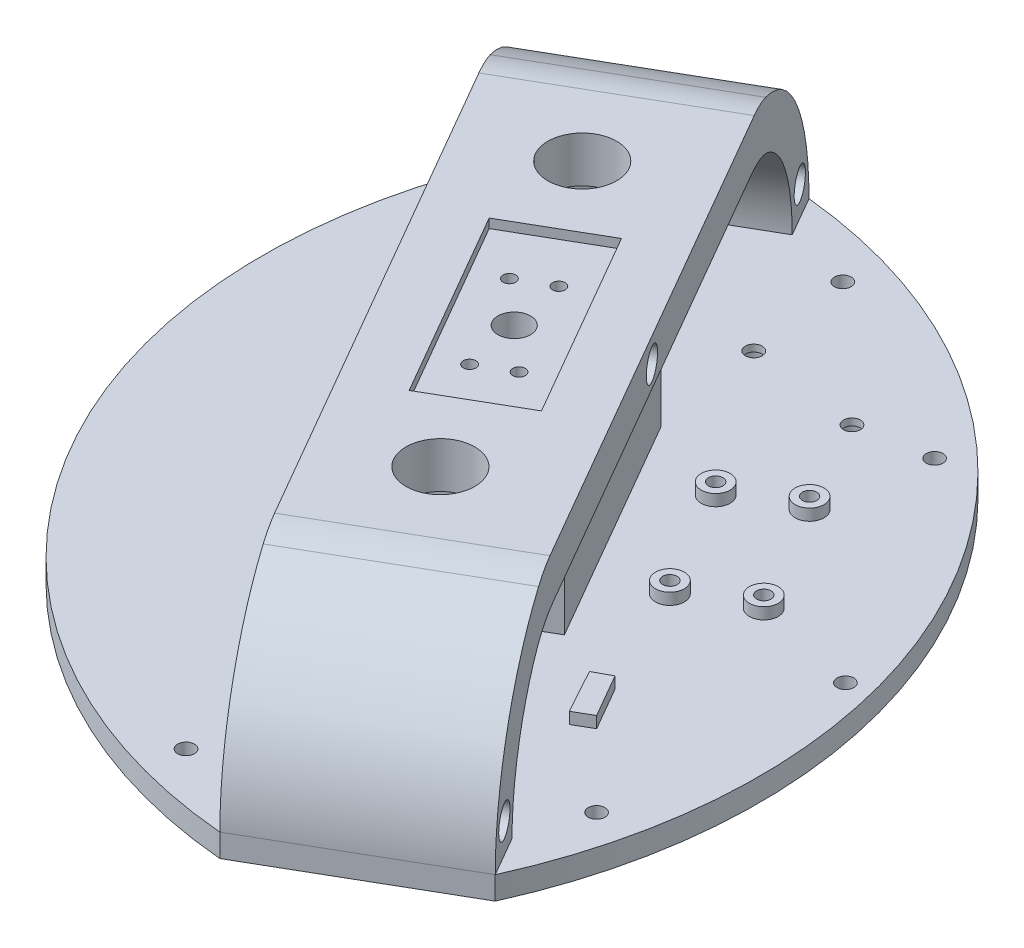
from build123d import *

# Parameters (mm, degrees)
BOSS_EXTRUDE1_DEPTH      = 8.255
SKETCH2_R                = 4.52165068
CUT_EXTRUDE1_DEPTH       = 24.892
BOSS_EXTRUDE2_DEPTH      = 2.54
BOSS_EXTRUDE2_DEPTH_BACK = 19.05
BOSS_EXTRUDE3_DEPTH      = 55.87439679
SKETCH8_W                = 306.493093546
SKETCH8_H                = 19.05
BOSS_EXTRUDE4_DEPTH      = 55.87439679
SKETCH9_R                = 88.9
BOSS_EXTRUDE5_DEPTH      = 19.05
SKETCH10_W               = 191.766813877
SKETCH10_H               = 13.52799874
BOSS_EXTRUDE6_DEPTH      = 55.87439679
SKETCH12_R               = 1.75
CUT_EXTRUDE3_DEPTH       = 25.146
SKETCH14_R               = 9.525
CUT_EXTRUDE4_DEPTH       = 30.48
CUT_EXTRUDE5_DEPTH       = 55.118
SKETCH16_R               = 79.375
CUT_EXTRUDE6_DEPTH       = 16.129
CUT_EXTRUDE7_DEPTH       = 8.89
CUT_EXTRUDE8_DEPTH       = 2.54
SKETCH19_W               = 282.174011185
SKETCH19_H               = 80.01
CUT_EXTRUDE9_DEPTH       = 75.946
BOSS_EXTRUDE7_DEPTH      = 6.35
BOSS_EXTRUDE8_DEPTH      = 48.26
SKETCH22_W               = 20.018863695
SKETCH22_H               = 30.79393733
CUT_EXTRUDE10_DEPTH      = 96.52
BOSS_EXTRUDE9_DEPTH      = 55.87439679
FILLET1_R                = 25.4
SKETCH24_W               = 0.282619494
SKETCH24_H               = 12.7
BOSS_EXTRUDE10_DEPTH     = 55.87439679
FILLET2_R                = 25.4
SKETCH25_R               = 2.3368
CUT_EXTRUDE11_DEPTH      = 21.336
SKETCH27_R               = 4.627670089
BOSS_EXTRUDE11_DEPTH     = 6.35
SKETCH29_R               = 2.3368
BOSS_EXTRUDE13_DEPTH     = 6.35
SKETCH30_R               = 2.3241
CUT_EXTRUDE13_DEPTH      = 48.514
SKETCH31_R               = 4.25
CUT_EXTRUDE14_DEPTH      = 4
SKETCH33_R               = 4
BOSS_EXTRUDE14_DEPTH     = 3.175
CUT_EXTRUDE16_DEPTH      = 3.175
CUT_EXTRUDE16_DEPTH_BACK = 3.525012
SKETCH32_R               = 2
SKETCH34_R               = 4
SKETCH34_R_2             = 1.7
BOSS_EXTRUDE15_DEPTH     = 3.175
SKETCH35_R               = 2
CUT_EXTRUDE17_DEPTH      = 6.7
SKETCH26_R               = 3.556
SKETCH26_R_2             = 2.3368
CUT_EXTRUDE12_DEPTH      = 4.318
SKETCH37_R               = 3.556
CUT_EXTRUDE18_DEPTH      = 4.445
SKETCH6_R                = 3.05
SKETCH6_R_2              = 1.75
CUT_EXTRUDE2_DEPTH       = 24.892


with BuildPart() as part:
    # Sketch1 → Boss-Extrude1 (new, symmetric)
    with BuildSketch(Plane(origin=(0, 0, 0), x_dir=(1, 0, 0), z_dir=(0, 1, 0))):
        Polygon((-26.685513069, 19.73834527), (-3.435840979, 33.16154971), (26.859514241, -19.311544765), (3.609842152, -32.734749204), align=None)
    extrude(amount=BOSS_EXTRUDE1_DEPTH, both=True)

    # Sketch2 → Cut-Extrude1 (cut)
    with BuildSketch(Plane(origin=(0, 8.255, 0), x_dir=(1, 0, 0), z_dir=(0, 1, 0))):
        with Locations(Location((0, 0, 0), (0, 0, 270))):
            Circle(SKETCH2_R)
    extrude(amount=-CUT_EXTRUDE1_DEPTH, mode=Mode.SUBTRACT)

    # Sketch12 → Cut-Extrude3 (cut)
    with BuildSketch(Plane(origin=(0, 8.255, 0), x_dir=(1, 0, 0), z_dir=(0, 1, 0))):
        with Locations(Location((-3.182842434, 15.553762143, 0), (0, 0, 270))):
            Circle(SKETCH12_R)
        with Locations(Location((3.182843419, -15.553761764, 0), (0, 0, 270))):
            Circle(SKETCH12_R)
        with Locations(Location((-11.87853102, 10.533303997, 0), (0, 0, 270))):
            Circle(SKETCH12_R)
        with Locations(Location((11.878532006, -10.533303617, 0), (0, 0, 270))):
            Circle(SKETCH12_R)
    extrude(amount=-CUT_EXTRUDE3_DEPTH, mode=Mode.SUBTRACT)


with BuildPart() as body_2:
    # Sketch3 → Boss-Extrude2 (new, two sides: drawn at the far end of the back side and taken through both)
    with BuildSketch(Plane(origin=(0, 8.255, 0), x_dir=(1, 0, 0), z_dir=(0, 1, 0)).offset(-BOSS_EXTRUDE2_DEPTH_BACK)):
        Polygon((-10.314271596, 73.739239236), (-58.702918637, 45.802040841), (10.314271596, -73.739239236), (58.702918637, -45.802040841), align=None)
        Polygon((-26.685513069, 19.73834527), (3.609842152, -32.734749204), (26.859514241, -19.311544765), (-3.435840979, 33.16154971), align=None, mode=Mode.SUBTRACT)
    extrude(amount=BOSS_EXTRUDE2_DEPTH + BOSS_EXTRUDE2_DEPTH_BACK)

    # Sketch7 → Boss-Extrude3 (add)
    with BuildSketch(Plane(origin=(-24.19432352, 0, 13.968599197), x_dir=(0.5000000000000003, 0, 0.8660254037844384), z_dir=(-0.8660254037844385, 0, 0.5000000000000004))):
        Polygon((-90.607190232, 10.795), (-118.92932164, -90.805), (-97.33932164, -90.805), (-69.017190232, -10.795), (-69.017190232, 10.795), align=None)
    boss_extrude3 = extrude(amount=-BOSS_EXTRUDE3_DEPTH)

    # Sketch8 → Boss-Extrude4 (add)
    with BuildSketch(Plane(origin=(-24.19432352, 0, 13.968599197), x_dir=(0.5000000000000003, 0, 0.8660254037844384), z_dir=(-0.8660254037844385, 0, 0.5000000000000004))):
        with Locations((0, -100.33)):
            Rectangle(SKETCH8_W, SKETCH8_H)
    extrude(amount=-BOSS_EXTRUDE4_DEPTH)

    # Mirror1: Boss-Extrude3 across plane
    add(boss_extrude3.mirror(Plane(origin=(-0.070654873, 0, -0.122377831), x_dir=(-0.8660254037844366, 0, 0.5000000000000038), z_dir=(0.5000000000000041, 0, 0.8660254037844364))))

    # Sketch9 → Boss-Extrude5 (add)
    with BuildSketch(Plane(origin=(0, -90.805, 0), x_dir=(1, 0, 0), z_dir=(0, 1, 0))):
        Circle(SKETCH9_R)
    extrude(amount=-BOSS_EXTRUDE5_DEPTH)

    # Sketch10 → Boss-Extrude6 (add)
    with BuildSketch(Plane(origin=(-24.19432352, 0, 13.968599197), x_dir=(0.5000000000000047, 0, 0.866025403784436), z_dir=(-0.866025403784436, 0, 0.5000000000000047))):
        with Locations((-2.1166315, -68.398848488)):
            Rectangle(SKETCH10_W, SKETCH10_H)
    extrude(amount=-BOSS_EXTRUDE6_DEPTH)

    # Sketch14 → Cut-Extrude4 (cut)
    with BuildSketch(Plane(origin=(0, 10.795, 0), x_dir=(1, 0, 0), z_dir=(0, 1, 0))):
        with Locations(Location((26.237529429, -46.700320482, 0), (0, 0, 270))):
            Circle(SKETCH14_R)
    cut_extrude4 = extrude(amount=-CUT_EXTRUDE4_DEPTH, mode=Mode.SUBTRACT)

    # Mirror2: Cut-Extrude4 across plane
    add(cut_extrude4.mirror(Plane(origin=(-0.070654873, 0, -0.122377831), x_dir=(-0.8660254037844366, 0, 0.5000000000000038), z_dir=(0.5000000000000041, 0, 0.8660254037844364))), mode=Mode.SUBTRACT)

    # Sketch15 → Cut-Extrude5 (cut)
    with BuildSketch(Plane(origin=(0, -90.805, 0), x_dir=(1, 0, 0), z_dir=(0, 1, 0))):
        Polygon((100.817596907, -118.746803351), (83.517674594, -88.782458937), (35.129027553, -116.719657331), (52.428949866, -146.684001745), align=None)
        Polygon((-83.658984341, 89.027214598), (-35.2703373, 116.964412993), (-52.428949866, 146.684001745), (-100.817596907, 118.746803351), align=None)
    extrude(amount=-CUT_EXTRUDE5_DEPTH, mode=Mode.SUBTRACT)

    # Sketch16 → Cut-Extrude6 (cut)
    with BuildSketch(Plane(origin=(0, -90.805, 0), x_dir=(1, 0, 0), z_dir=(0, 1, 0))):
        with Locations(Location((0, 0, 0), (0, 0, 270))):
            Circle(SKETCH16_R)
    extrude(amount=-CUT_EXTRUDE6_DEPTH, mode=Mode.SUBTRACT)


with BuildPart() as cut_extrude7_tool:
    # Sketch17 → Cut-Extrude7 (new body)
    with BuildSketch(Plane(origin=(0, 10.795, 0), x_dir=(1, 0, 0), z_dir=(0, 1, 0))):
        Polygon((27.82393906, -104.066872908), (76.212586101, -76.129674513), (-31.017857396, 109.598901741), (-79.406504437, 81.661703346), align=None)
    extrude(amount=-CUT_EXTRUDE7_DEPTH)


with BuildPart() as part_1:
    add(part.part)

    # Cut-Extrude7: cut by cut_extrude7_tool
    add(cut_extrude7_tool.part, mode=Mode.SUBTRACT)

    # Sketch18 → Cut-Extrude8 (cut)
    with BuildSketch(Plane(origin=(0, 1.905, 0), x_dir=(1, 0, 0), z_dir=(0, 1, 0))):
        Polygon((-26.685513069, 19.73834527), (3.609842152, -32.734749204), (26.859514241, -19.311544765), (-3.435840979, 33.16154971), align=None)
    extrude(amount=-CUT_EXTRUDE8_DEPTH, mode=Mode.SUBTRACT)


with BuildPart() as body_2_1:
    add(body_2.part)

    # Cut-Extrude7: cut by cut_extrude7_tool
    add(cut_extrude7_tool.part, mode=Mode.SUBTRACT)

    # Sketch19 → Cut-Extrude9 (cut)
    with BuildSketch(Plane(origin=(-24.19432352, 0, 13.968599197), x_dir=(0.5000000000000047, 0, 0.866025403784436), z_dir=(-0.866025403784436, 0, 0.5000000000000047))):
        with Locations((-0.70763264, -50.8)):
            Rectangle(SKETCH19_W, SKETCH19_H)
    extrude(amount=-CUT_EXTRUDE9_DEPTH, mode=Mode.SUBTRACT)


with BuildPart() as cut_extrude9_piece_1:
    # of the separate pieces the step leaves, piece 1, a body of its own (cut_extrude9_pieces)
    add(body_2_1.part.solids().sort_by_distance((-83.658984341, -90.805, -89.027214598))[0])


with BuildPart() as cut_extrude9_piece_2:
    # of the separate pieces the step leaves, piece 2, a body of its own (cut_extrude9_pieces)
    add(body_2_1.part.solids().sort_by_distance((-70.737011886, 1.905, -66.645701772))[0])


with BuildPart() as cut_extrude9_piece_2_1:
    # Body-Move/Copy1: moved
    add(cut_extrude9_piece_2.part.moved(Location((0, -38.1, 0))))


with BuildPart() as part_2:
    # Body-Move/Copy1: moved
    add(part_1.part.moved(Location((0, -38.1, 0))))


with BuildPart() as cut_extrude9_piece_2_2:
    add(cut_extrude9_piece_2_1.part)

    # Combine1: union part
    add(part_2.part)



with BuildPart() as body_3:
    # Sketch20 → Boss-Extrude7 (new body)
    with BuildSketch(Plane(origin=(0, -90.805, 0), x_dir=(1, 0, 0), z_dir=(0, 1, 0))):
        with BuildLine():
            Line((-18.003789429, 87.057874809), (-35.2703373, 116.964412993))
            Line((-35.2703373, 116.964412993), (-83.658984341, 89.027214598))
            Line((-83.658984341, 89.027214598), (-66.39243647, 59.120676414))
            ThreePointArc((-66.39243647, 59.120676414), (-76.989658396, -44.45), (18.003789429, -87.057874809))
            Line((18.003789429, -87.057874809), (35.129027553, -116.719657331))
            Line((35.129027553, -116.719657331), (83.517674594, -88.782458937))
            Line((83.517674594, -88.782458937), (66.39243647, -59.120676414))
            ThreePointArc((66.39243647, -59.120676414), (76.989658396, 44.45), (-18.003789429, 87.057874809))
        make_face()
    extrude(amount=BOSS_EXTRUDE7_DEPTH)


with BuildPart() as cut_extrude9_piece_2_3:
    add(cut_extrude9_piece_2_2.part)

    add(body_3.part)  # Boss-Extrude8 merges body 3
    # Sketch21 → Boss-Extrude8 (add)
    with BuildSketch(Plane(origin=(0, -36.195, 0), x_dir=(1, 0, 0), z_dir=(0, 1, 0))):
        Polygon((3.609842152, -32.734749204), (26.859514241, -19.311544765), (-3.435840979, 33.16154971), (-26.685513069, 19.73834527), (-29.860513069, 25.237606584), (-1.111579665, 41.835811024), (35.533775555, -21.635806079), (6.784842152, -38.234010518), align=None)
    extrude(amount=-BOSS_EXTRUDE8_DEPTH)

    # Sketch22 → Cut-Extrude10 (cut)
    with BuildSketch(Plane(origin=(-24.19432352, 0, 13.968599197), x_dir=(0.5000000000000047, 0, 0.866025403784436), z_dir=(-0.866025403784436, 0, 0.5000000000000047))):
        with Locations((-90.850482288, -41.491292788)):
            Rectangle(SKETCH22_W, SKETCH22_H)
        with Locations((90.850482288, -41.491292788)):
            Rectangle(SKETCH22_W, SKETCH22_H)
    extrude(amount=-CUT_EXTRUDE10_DEPTH, mode=Mode.SUBTRACT)

    # Sketch23 → Boss-Extrude9 (add)
    with BuildSketch(Plane(origin=(-24.19432352, 0, 13.968599197), x_dir=(0.5000000000000047, 0, 0.866025403784436), z_dir=(-0.866025403784436, 0, 0.5000000000000047))):
        with BuildLine():
            Line((80.84105044, -48.895), (80.84105044, -36.195))
            ThreePointArc((80.84105044, -36.195), (108.069992547, -53.80253313), (118.646702146, -84.455))
            Line((118.646702146, -84.455), (105.946702146, -84.455))
            ThreePointArc((105.946702146, -84.455), (99.037850994, -62.690307562), (80.84105044, -48.895))
        make_face()
    boss_extrude9 = extrude(amount=-BOSS_EXTRUDE9_DEPTH)

    # Fillet1
    fillet1_edges = [cut_extrude9_piece_2_3.edges().sort_by_distance(p)[0] for p in [
        (40.42052522, -36.195, 70.010403349),
        (40.42052522, -48.895, 70.010403349),
    ]]
    fillet(fillet1_edges, radius=FILLET1_R)

    # Mirror5: Boss-Extrude9 across plane
    add(boss_extrude9.mirror(Plane(origin=(-0.070654873, 0, -0.122377831), x_dir=(-0.8660254037844366, 0, 0.5000000000000038), z_dir=(0.5000000000000041, 0, 0.8660254037844364))))

    # Sketch24 → Boss-Extrude10 (add)
    with BuildSketch(Plane(origin=(-24.19432352, 0, 13.968599197), x_dir=(0.5000000000000047, 0, 0.866025403784436), z_dir=(-0.866025403784436, 0, 0.5000000000000047))):
        with Locations((-80.982360187, -42.545)):
            Rectangle(SKETCH24_W, SKETCH24_H)
    extrude(amount=-BOSS_EXTRUDE10_DEPTH)

    # Fillet2
    fillet2_edges = [cut_extrude9_piece_2_3.edges().sort_by_distance(p)[0] for p in [
        (-40.561834967, -48.895, -70.255159011),
        (-40.561834967, -36.195, -70.255159011),
    ]]
    fillet(fillet2_edges, radius=FILLET2_R)

    # Sketch25 → Cut-Extrude11 (cut)
    with BuildSketch(Plane.XZ.offset(90.805)):
        with Locations(Location((-36.5125, -63.241505111, 0), (0, 0, 270))):
            Circle(SKETCH25_R)
        with Locations(Location((-59.818578034, -41.885419265, 0), (0, 0, 270))):
            Circle(SKETCH25_R)
        with Locations(Location((-71.915586164, -12.680658174, 0), (0, 0, 270))):
            Circle(SKETCH25_R)
        with Locations(Location((-6.364548114, -72.747117828, 0), (0, 0, 90))):
            Circle(SKETCH25_R)
        with Locations(Location((24.976020966, -68.621053633, 0), (0, 0, 90))):
            Circle(SKETCH25_R)
    extrude(amount=-CUT_EXTRUDE11_DEPTH, mode=Mode.SUBTRACT)

    # Sketch27 → Boss-Extrude11 (add)
    with BuildSketch(Plane(origin=(0, -84.455, 0), x_dir=(1, 0, 0), z_dir=(0, 1, 0))):
        with Locations((-72.217270858, 13.520359966)):
            Circle(SKETCH27_R)
    extrude(amount=-BOSS_EXTRUDE11_DEPTH)

    # Sketch29 → Boss-Extrude13 (add)
    # profile 1 of 2: a face of its own
    with BuildSketch(Plane(origin=(0, -84.455, 0), x_dir=(1, 0, 0), z_dir=(0, 1, 0))):
        with BuildLine():
            Line((-83.658984341, 89.027214598), (35.129027553, -116.719657331))
            ThreePointArc((35.129027553, -116.719657331), (-77.953106839, -44.843076777), (-83.658984341, 89.027214598))
        make_face()
        with Locations(Location((-59.818578034, 41.885419265, 0), (0, 0, 90))):
            Circle(SKETCH29_R, mode=Mode.SUBTRACT)
    # profile 2 of 2: a face of its own
    with BuildSketch(Plane(origin=(0, -84.455, 0), x_dir=(1, 0, 0), z_dir=(0, 1, 0))):
        with BuildLine():
            Line((-35.2703373, 116.964412993), (83.517674594, -88.782458937))
            ThreePointArc((83.517674594, -88.782458937), (76.919154391, 44.572464934), (-35.2703373, 116.964412993))
        make_face()
        with Locations(Location((24.976020966, 68.621053633, 0), (0, 0, 270))):
            Circle(SKETCH29_R, mode=Mode.SUBTRACT)
        with Locations(Location((-6.364548114, 72.747117828, 0), (0, 0, 270))):
            Circle(SKETCH29_R, mode=Mode.SUBTRACT)
    extrude(amount=-BOSS_EXTRUDE13_DEPTH)

    # Sketch30 → Cut-Extrude13 (cut)
    with BuildSketch(Plane(origin=(0, -84.455, 0), x_dir=(1, 0, 0), z_dir=(0, 1, 0))):
        with Locations(Location((-82.751596824, 60.030173011, 0), (0, 0, 270))):
            Circle(SKETCH30_R)
        with Locations(Location((-10.611856409, 101.680071559, 0), (0, 0, 270))):
            Circle(SKETCH30_R)
        with Locations(Location((44.477086399, 72.035469588, 0), (0, 0, 270))):
            Circle(SKETCH30_R)
        with Locations(Location((85.977502807, 5.810881587, 0), (0, 0, 270))):
            Circle(SKETCH30_R)
        with Locations(Location((82.610287077, -59.78541735, 0), (0, 0, 270))):
            Circle(SKETCH30_R)
        with Locations(Location((10.470546662, -101.435315897, 0), (0, 0, 270))):
            Circle(SKETCH30_R)
    extrude(amount=-CUT_EXTRUDE13_DEPTH, mode=Mode.SUBTRACT)

    # Sketch31 → Cut-Extrude14 (cut)
    with BuildSketch(Plane(origin=(-24.19432352, 0, 13.968599197), x_dir=(0.5000000000000047, 0, 0.866025403784436), z_dir=(-0.866025403784436, 0, 0.5000000000000047))):
        with Locations((-111.964311164, -76.246071585)):
            Circle(SKETCH31_R)
        with Locations((0, -42.944679699)):
            Circle(SKETCH31_R)
        with Locations((111.758462511, -76.246071585)):
            Circle(SKETCH31_R)
    cut_extrude14 = extrude(amount=-CUT_EXTRUDE14_DEPTH, mode=Mode.SUBTRACT)

    # Mirror6: Cut-Extrude14 across plane
    add(cut_extrude14.mirror(Plane(origin=(0, 0, 0), x_dir=(0.5000000000000042, 0, 0.8660254037844362), z_dir=(-0.8660254037844363, 0, 0.5000000000000042))), mode=Mode.SUBTRACT)

    # Sketch33 → Boss-Extrude14 (add)
    with BuildSketch(Plane(origin=(0, -84.455, 0), x_dir=(1, 0, 0), z_dir=(0, 1, 0))):
        with Locations(Location((39.427227366, 42.430537568, 0), (0, 0, 270))):
            Circle(SKETCH33_R)
        with Locations(Location((22.929443424, 32.905537568, 0), (0, 0, 270))):
            Circle(SKETCH33_R)
        with Locations(Location((40.264943424, 2.879570793, 0), (0, 0, 270))):
            Circle(SKETCH33_R)
        with Locations(Location((56.762727366, 12.404570793, 0), (0, 0, 270))):
            Circle(SKETCH33_R)
    extrude(amount=BOSS_EXTRUDE14_DEPTH)

    # Sketch32 → Cut-Extrude16 (cut, two sides: drawn at the far end of the back side and taken through both)
    with BuildSketch(Plane(origin=(0, -84.455, 0), x_dir=(1, 0, 0), z_dir=(0, 1, 0)).offset(-CUT_EXTRUDE16_DEPTH_BACK)):
        with Locations(Location((39.427227366, 42.430537568, 0), (0, 0, 270))):
            Circle(SKETCH32_R)
        with Locations(Location((22.929443424, 32.905537568, 0), (0, 0, 270))):
            Circle(SKETCH32_R)
        with Locations(Location((56.762727366, 12.404570793, 0), (0, 0, 270))):
            Circle(SKETCH32_R)
        with Locations(Location((40.264943424, 2.879570793, 0), (0, 0, 270))):
            Circle(SKETCH32_R)
    extrude(amount=CUT_EXTRUDE16_DEPTH + CUT_EXTRUDE16_DEPTH_BACK, mode=Mode.SUBTRACT)

    # Sketch34 → Boss-Extrude15 (add)
    # profile 1 of 5: a face of its own
    with BuildSketch(Plane(origin=(0, -84.455, 0), x_dir=(1, 0, 0), z_dir=(0, 1, 0))):
        Polygon((55.558304724, -27.612862565), (50.968106057, -30.139160086), (57.744566136, -42.451762923), (62.530302414, -39.688716794), align=None)
    # profile 2 of 5: a face of its own
    with BuildSketch(Plane(origin=(0, -84.455, 0), x_dir=(1, 0, 0), z_dir=(0, 1, 0))):
        with Locations(Location((-3.957558623, -56.491893391, 0), (0, 0, 270))):
            Circle(SKETCH34_R)
        with Locations((-3.957558623, -56.491893391)):
            Circle(SKETCH34_R_2, mode=Mode.SUBTRACT)
    # profile 3 of 5: a face of its own
    with BuildSketch(Plane(origin=(0, -84.455, 0), x_dir=(1, 0, 0), z_dir=(0, 1, 0))):
        with Locations((-3.957558623, -56.491893391)):
            Circle(SKETCH34_R_2)
    # profile 4 of 5: a face of its own
    with BuildSketch(Plane(origin=(0, -84.455, 0), x_dir=(1, 0, 0), z_dir=(0, 1, 0))):
        with Locations(Location((10.306708306, -80.871668445, 0), (0, 0, 270))):
            Circle(SKETCH34_R)
        with Locations((10.306708306, -80.871668445)):
            Circle(SKETCH34_R_2, mode=Mode.SUBTRACT)
    # profile 5 of 5: a face of its own
    with BuildSketch(Plane(origin=(0, -84.455, 0), x_dir=(1, 0, 0), z_dir=(0, 1, 0))):
        with Locations((10.306708306, -80.871668445)):
            Circle(SKETCH34_R_2)
    extrude(amount=BOSS_EXTRUDE15_DEPTH)

    # Sketch35 → Cut-Extrude17 (cut)
    with BuildSketch(Plane(origin=(0, -81.28, 0), x_dir=(1, 0, 0), z_dir=(0, 1, 0))):
        with Locations(Location((-3.957558623, -56.491893391, 0), (0, 0, 270))):
            Circle(SKETCH35_R)
        with Locations(Location((10.306708306, -80.871668445, 0), (0, 0, 270))):
            Circle(SKETCH35_R)
    extrude(amount=-CUT_EXTRUDE17_DEPTH, mode=Mode.SUBTRACT)

    # Sketch26 → Cut-Extrude12 (cut)
    # profile 1 of 4: a face of its own
    with BuildSketch(Plane.XZ.offset(90.805)):
        with Locations(Location((-59.818578034, -41.885419265, 0), (0, 0, 270))):
            Circle(SKETCH26_R)
        with Locations(Location((-59.818578034, -41.885419265, 0), (0, 0, 270))):
            Circle(SKETCH26_R_2, mode=Mode.SUBTRACT)
    # profile 2 of 4: a face of its own
    with BuildSketch(Plane.XZ.offset(90.805)):
        with Locations(Location((-36.5125, -63.241505111, 0), (0, 0, 270))):
            Circle(SKETCH26_R)
        with Locations(Location((-36.5125, -63.241505111, 0), (0, 0, 270))):
            Circle(SKETCH26_R_2, mode=Mode.SUBTRACT)
    # profile 3 of 4: a face of its own
    with BuildSketch(Plane.XZ.offset(90.805)):
        with Locations(Location((-6.364548114, -72.747117828, 0), (0, 0, 270))):
            Circle(SKETCH26_R)
        with Locations(Location((-6.364548114, -72.747117828, 0), (0, 0, 270))):
            Circle(SKETCH26_R_2, mode=Mode.SUBTRACT)
    # profile 4 of 4: a face of its own
    with BuildSketch(Plane.XZ.offset(90.805)):
        with Locations(Location((24.976020966, -68.621053633, 0), (0, 0, 270))):
            Circle(SKETCH26_R)
        with Locations(Location((24.976020966, -68.621053633, 0), (0, 0, 270))):
            Circle(SKETCH26_R_2, mode=Mode.SUBTRACT)
    extrude(amount=-CUT_EXTRUDE12_DEPTH, mode=Mode.SUBTRACT)

    # Sketch37 → Cut-Extrude18 (cut)
    with BuildSketch(Plane.XZ.offset(90.805)):
        with Locations(Location((24.976020966, -68.621053633, 0), (0, 0, 270))):
            Circle(SKETCH37_R)
        with Locations(Location((-6.364548114, -72.747117828, 0), (0, 0, 270))):
            Circle(SKETCH37_R)
        with Locations(Location((-36.5125, -63.241505111, 0), (0, 0, 270))):
            Circle(SKETCH37_R)
        with Locations(Location((-59.818578034, -41.885419265, 0), (0, 0, 270))):
            Circle(SKETCH37_R)
    extrude(amount=-CUT_EXTRUDE18_DEPTH, mode=Mode.SUBTRACT)

    # Sketch6 → Cut-Extrude2 (cut)
    with BuildSketch(Plane.XZ.offset(6.35)):
        Circle(SKETCH6_R)
        with Locations(Location((-11.878531513, -10.533303807, 0), (0, 0, 89.999983872))):
            Circle(SKETCH6_R_2)
        with Locations(Location((11.878531513, 10.533303807, 0), (0, 0, 89.999983872))):
            Circle(SKETCH6_R_2)
        with Locations(Location((-3.182842926, -15.553761954, 0), (0, 0, 89.999983872))):
            Circle(SKETCH6_R_2)
        with Locations(Location((3.182842926, 15.553761954, 0), (0, 0, 89.999983872))):
            Circle(SKETCH6_R_2)
    extrude(amount=-CUT_EXTRUDE2_DEPTH, mode=Mode.SUBTRACT)


solid = cut_extrude9_piece_2_3.part
